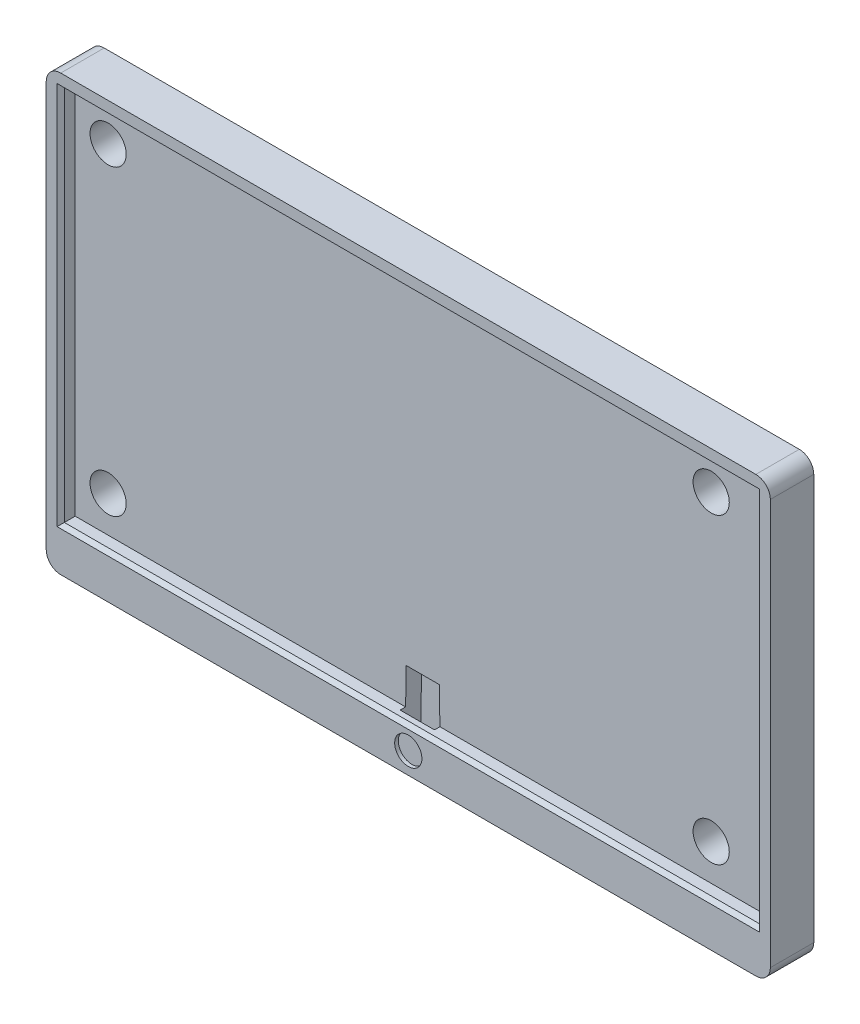
from build123d import *

# Parameters (mm, degrees)
BOSS_EXTRUDE1_DEPTH      = 3
BOSS_EXTRUDE1_DEPTH_BACK = 3
SKETCH1_W                = 100
SKETCH1_H                = 60
SKETCH2_W                = 4.95
SKETCH2_H                = 2.9
CUT_EXTRUDE1_DEPTH       = 11
DRAFT1_ANGLE             = 1
SKETCH3_W                = 96
SKETCH3_H                = 52
CUT_EXTRUDE2_DEPTH       = 2
FILLET1_R                = 2
SKETCH4_R                = 2.5
CUT_EXTRUDE3_DEPTH       = 59.446556785
CHAMFER1_SIZE            = 0.5
SKETCH5_R                = 1.882569545
CUT_EXTRUDE4_DEPTH       = 0.5


with BuildPart() as part:
    # Sketch1 → Boss-Extrude1 (new, two sides: drawn at the far end of the back side and taken through both)
    with BuildSketch(Plane.XY.offset(-BOSS_EXTRUDE1_DEPTH_BACK)):
        Rectangle(SKETCH1_W, SKETCH1_H)
    extrude(amount=BOSS_EXTRUDE1_DEPTH + BOSS_EXTRUDE1_DEPTH_BACK)

    # Sketch2 → Cut-Extrude1 (cut)
    with BuildSketch(Plane.XZ.offset(30)):
        with Locations((0, 0.3)):
            Rectangle(SKETCH2_W, SKETCH2_H)
    extrude(amount=-CUT_EXTRUDE1_DEPTH, mode=Mode.SUBTRACT)

    # Draft1
    draft1_faces = [part.faces().sort_by_distance(p)[0] for p in [
        (-2.475, -24.5, 0.3),
        (2.475, -24.5, 0.3),
    ]]
    draft(draft1_faces, Plane(origin=(-50, -30, -3), x_dir=(-1, 0, 0), z_dir=(0, -1, 0)), DRAFT1_ANGLE)

    # Sketch3 → Cut-Extrude2 (cut)
    with BuildSketch(Plane.XY.offset(3)):
        with Locations((0, 2)):
            Rectangle(SKETCH3_W, SKETCH3_H)
    extrude(amount=-CUT_EXTRUDE2_DEPTH, mode=Mode.SUBTRACT)

    # Fillet1
    fillet1_edges = [part.edges().sort_by_distance(p)[0] for p in [
        (-50, 30, 0),
        (50, -30, 0),
        (50, 30, 0),
        (-50, -30, 0),
    ]]
    fillet(fillet1_edges, radius=FILLET1_R)

    # Sketch4 → Cut-Extrude3 (cut, through all)
    with BuildSketch(Plane.XY.offset(1)):
        with Locations((-43.453932042, 22.8)):
            Circle(SKETCH4_R)
        with Locations((-43.453932042, -19)):
            Circle(SKETCH4_R)
        with Locations((39.832771039, -19)):
            Circle(SKETCH4_R)
        with Locations((39.832771039, 22.8)):
            Circle(SKETCH4_R)
    extrude(amount=-CUT_EXTRUDE3_DEPTH, mode=Mode.SUBTRACT)

    # Chamfer1
    chamfer1_edges = [part.edges().sort_by_distance(p)[0] for p in [
        (48, 2, 3),
        (0, 28, 3),
        (-48, 2, 3),
        (0, -24, 3),
    ]]
    chamfer(chamfer1_edges, length=CHAMFER1_SIZE)

    # Sketch5 → Cut-Extrude4 (cut)
    with BuildSketch(Plane.XY.offset(3)):
        with Locations((0, -27.056295937)):
            Circle(SKETCH5_R)
    extrude(amount=-CUT_EXTRUDE4_DEPTH, mode=Mode.SUBTRACT)


solid = part.part
